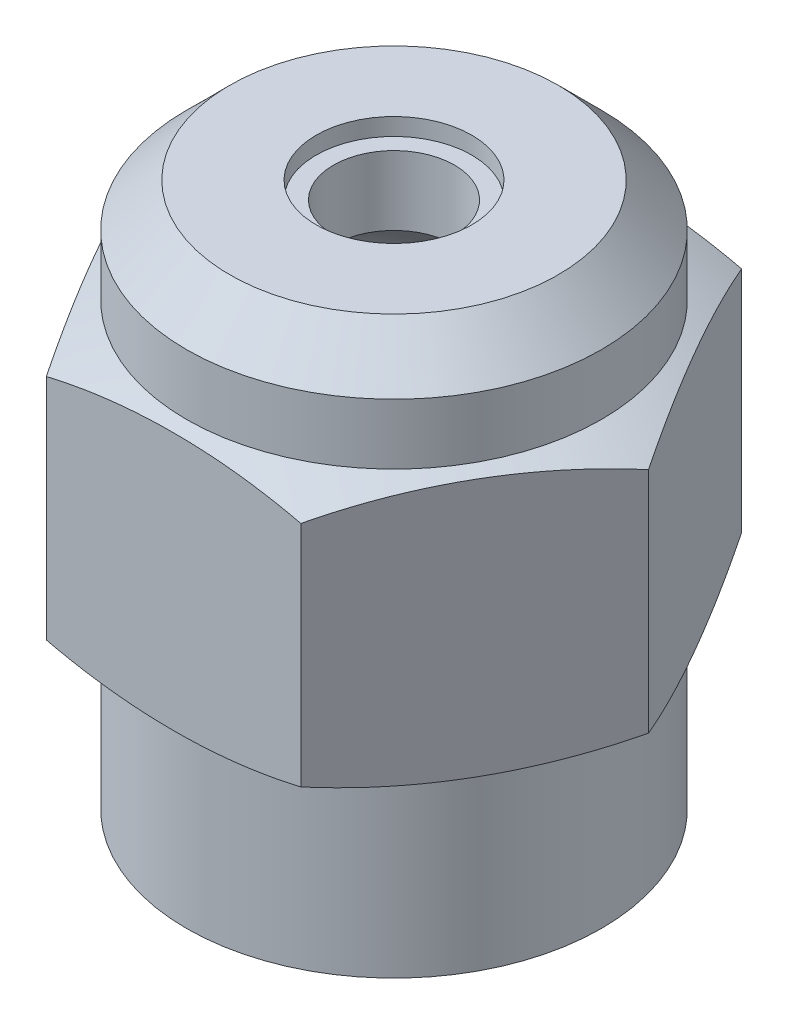
from build123d import *

# Parameters (mm, degrees)
SKETCH3_R           = 6.096
BOSS_EXTRUDE1_DEPTH = 7.874


with BuildPart() as part:
    # Sketch1 → Base-Revolve (revolve)
    with BuildSketch(Plane.XY, mode=Mode.PRIVATE) as base_revolve_sk:
        with BuildLine():
            Line((6.096, 0), (6.096, 14.732))
            Line((6.096, 14.732), (4.826, 16.002))
            Line((4.826, 16.002), (2.286, 16.002))
            Line((2.286, 16.002), (2.286, 15.494))
            Line((2.286, 15.494), (1.778, 15.494))
            Line((1.778, 15.494), (1.778, 13.462))
            ThreePointArc((1.778, 13.462), (3.53667068, 11.915498853), (4.191, 9.666845589))
            Line((4.191, 9.666845589), (4.191, 0))
            Line((4.191, 0), (6.096, 0))
        make_face()
    revolve(base_revolve_sk.sketch.rotate(Axis((0, 0, 0), (0, 1, 0)), 90), axis=Axis((0, 0, 0), (0, 1, 0)))

    # Sketch3 → Boss-Extrude1 (add)
    with BuildSketch(Plane(origin=(0, 12.954, 0), x_dir=(-1, 0, 0), z_dir=(0, 1, 0))):
        Polygon((3.739497694, -6.477), (-3.739497694, -6.477), (-7.478995387, 0), (-3.739497694, 6.477), (3.739497694, 6.477), (7.478995387, 0), align=None)
        with Locations(Location((0, 0, 0), (0, 0, 270))):
            Circle(SKETCH3_R, mode=Mode.SUBTRACT)
    extrude(amount=-BOSS_EXTRUDE1_DEPTH)

    # Sketch4 → Cut-Revolve1 (revolve, cut)
    with BuildSketch(Plane.XY):
        with BuildLine():
            Line((7.478995387, 12.954), (6.096, 12.954))
            ThreePointArc((6.096, 12.954), (6.793780049, 12.676772421), (7.478995387, 12.3698))
            Line((7.478995387, 12.3698), (7.478995387, 12.954))
        make_face()
    cut_revolve1 = revolve(axis=Axis((0, 0, 0), (0, 1, 0)), mode=Mode.SUBTRACT)

    # Mirror1: Cut-Revolve1 across plane
    add(cut_revolve1.mirror(Plane.ZX.offset(9.017)), mode=Mode.SUBTRACT)


solid = part.part
